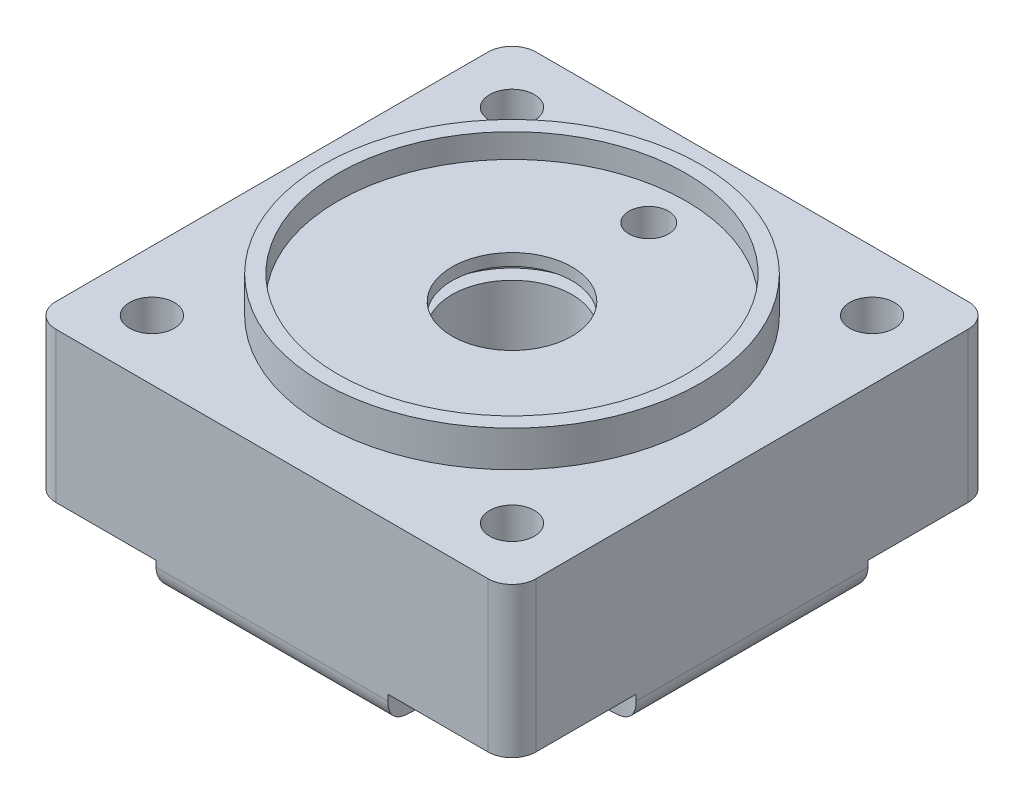
from build123d import *

# Parameters (mm, degrees)
ESQUISSE1_R                  = 31.5
ESQUISSE1_R_2                = 29
BOSS_EXTRU_1_DEPTH           = 6
ESQUISSE2_R                  = 29
BOSS_EXTRU_2_DEPTH           = 2
ESQUISSE3_W                  = 80
ESQUISSE3_H                  = 80
BOSS_EXTRU_3_DEPTH           = 30
CONG_1_R                     = 4
ESQUISSE6_R                  = 20
BOSS_EXTRU_5_DEPTH           = 15
CONG_3_R                     = 4
ESQUISSE7_R                  = 10
ENL_V_MAT_EXTRU_2_DEPTH      = 77.164296097
ESQUISSE8_R                  = 17.170805795
ENL_V_MAT_EXTRU_3_DEPTH      = 5
ESQUISSE9_R                  = 3.731879986
ENL_V_MAT_EXTRU_4_DEPTH      = 65.505813816
R_P_TITION_CIRCULAIRE1_COUNT = 4
D_GAGEMENT_M61_D             = 6.6
D_GAGEMENT_M61_DEPTH         = 20
D_GAGEMENT_M61_TIP           = 1.982840043
D_GAGEMENT_M62_D             = 6.6
D_GAGEMENT_M62_DEPTH         = 20
D_GAGEMENT_M62_TIP           = 1.982840043
ESQUISSE14_R                 = 6
ENL_V_MAT_EXTRU_5_DEPTH      = 2
ESQUISSE15_R                 = 12.5
ENL_V_MAT_EXTRU_6_DEPTH      = 2


with BuildPart() as part:
    # Esquisse1 → Boss.-Extru.1 (new body)
    with BuildSketch(Plane(origin=(0, 0, 0), x_dir=(1, 0, 0), z_dir=(0, 1, 0))):
        with Locations(Location((0, 0, 0), (0, 0, 270))):
            Circle(ESQUISSE1_R)
        with Locations(Location((0, 0, 0), (0, 0, 270))):
            Circle(ESQUISSE1_R_2, mode=Mode.SUBTRACT)
    extrude(amount=BOSS_EXTRU_1_DEPTH)

    # Esquisse2 → Boss.-Extru.2 (add)
    with BuildSketch(Plane(origin=(0, 0, 0), x_dir=(1, 0, 0), z_dir=(0, 1, 0))):
        with Locations(Location((0, 0, 0), (0, 0, 270))):
            Circle(ESQUISSE2_R)
    extrude(amount=BOSS_EXTRU_2_DEPTH)

    # Esquisse3 → Boss.-Extru.3 (add)
    with BuildSketch(Plane.XZ):
        Rectangle(ESQUISSE3_W, ESQUISSE3_H)
    extrude(amount=BOSS_EXTRU_3_DEPTH)

    # Congé1
    cong_1_edges = [part.edges().sort_by_distance(p)[0] for p in [
        (-40, -15, 40),
        (-40, -15, -40),
        (40, -15, -40),
        (40, -15, 40),
        (-40, -30, 0),
        (0, -30, -40),
        (40, -30, 0),
        (0, -30, 40),
    ]]
    fillet(cong_1_edges, radius=CONG_1_R)

    # Esquisse6 → Boss.-Extru.5 (add)
    with BuildSketch(Plane.XZ.offset(30)):
        with Locations(Location((0, 0, 0), (0, 0, 270))):
            Circle(ESQUISSE6_R)
    extrude(amount=BOSS_EXTRU_5_DEPTH)

    # Congé3
    cong_3_edges = [part.edges().sort_by_distance(p)[0] for p in [
        (0, -30, 20),
        (0, -45, 20),
    ]]
    fillet(cong_3_edges, radius=CONG_3_R)

    # Esquisse7 → Enlèv. mat.-Extru.2 (cut, through all)
    with BuildSketch(Plane(origin=(0, -45, 0), x_dir=(-1, 0, 0), z_dir=(0, -1, 0))):
        with Locations(Location((0, 0, 0), (0, 0, 90))):
            Circle(ESQUISSE7_R)
    extrude(amount=-ENL_V_MAT_EXTRU_2_DEPTH, mode=Mode.SUBTRACT)

    # Esquisse8 → Enlèv. mat.-Extru.3 (cut)
    with BuildSketch(Plane.XZ.offset(30)):
        with Locations((36, -36)):
            Circle(ESQUISSE8_R)
    enl_v_mat_extru_3 = extrude(amount=-ENL_V_MAT_EXTRU_3_DEPTH, mode=Mode.SUBTRACT)

    # Esquisse9 → Enlèv. mat.-Extru.4 (cut, through all)
    with BuildSketch(Plane.XZ.offset(25)):
        with Locations(Location((30, -30, 0), (0, 0, 270))):
            Circle(ESQUISSE9_R)
    enl_v_mat_extru_4 = extrude(amount=-ENL_V_MAT_EXTRU_4_DEPTH, mode=Mode.SUBTRACT)

    # Répétition circulaire1: Enlèv. mat.-Extru.3, Enlèv. mat.-Extru.4 ×4 about axis
    r_p_tition_circulaire1_axis = Axis((0, 0, 0), (0, 1, 0))
    add([enl_v_mat_extru_3.rotate(r_p_tition_circulaire1_axis, i * 360 / R_P_TITION_CIRCULAIRE1_COUNT) for i in range(1, R_P_TITION_CIRCULAIRE1_COUNT)], mode=Mode.SUBTRACT)
    add([enl_v_mat_extru_4.rotate(r_p_tition_circulaire1_axis, i * 360 / R_P_TITION_CIRCULAIRE1_COUNT) for i in range(1, R_P_TITION_CIRCULAIRE1_COUNT)], mode=Mode.SUBTRACT)

    # Dégagement M61
    with Locations(Plane(origin=(0, 2, 0), x_dir=(1, 0, 0), z_dir=(0, 1, 0))):
        with Locations((0, 22.784568399)):
            Hole(D_GAGEMENT_M61_D / 2, depth=D_GAGEMENT_M61_DEPTH)
            with Locations((0, 0, -(D_GAGEMENT_M61_DEPTH + D_GAGEMENT_M61_TIP / 2))):  # 118° drill point
                Cone(0, D_GAGEMENT_M61_D / 2, D_GAGEMENT_M61_TIP, mode=Mode.SUBTRACT)

    # Dégagement M62
    with Locations(Plane(origin=(0, 0, -40), x_dir=(-1, 0, 0), z_dir=(0, 0, -1))):
        with Locations((0, -13.635863914)):
            Hole(D_GAGEMENT_M62_D / 2, depth=D_GAGEMENT_M62_DEPTH)
            with Locations((0, 0, -(D_GAGEMENT_M62_DEPTH + D_GAGEMENT_M62_TIP / 2))):  # 118° drill point
                Cone(0, D_GAGEMENT_M62_D / 2, D_GAGEMENT_M62_TIP, mode=Mode.SUBTRACT)

    # Esquisse14 → Enlèv. mat.-Extru.5 (cut)
    with BuildSketch(Plane(origin=(0, 0, -40), x_dir=(-1, 0, 0), z_dir=(0, 0, -1))):
        with Locations((0, -13.635863914)):
            Circle(ESQUISSE14_R)
    extrude(amount=-ENL_V_MAT_EXTRU_5_DEPTH, mode=Mode.SUBTRACT)

    # Esquisse15 → Enlèv. mat.-Extru.6 (cut)
    with BuildSketch(Plane(origin=(0, 0, 0), x_dir=(1, 0, 0), z_dir=(0, 1, 0))):
        with Locations(Location((0, 0, 0), (0, 0, 270))):
            Circle(ESQUISSE15_R)
    extrude(amount=-ENL_V_MAT_EXTRU_6_DEPTH, mode=Mode.SUBTRACT)


solid = part.part
